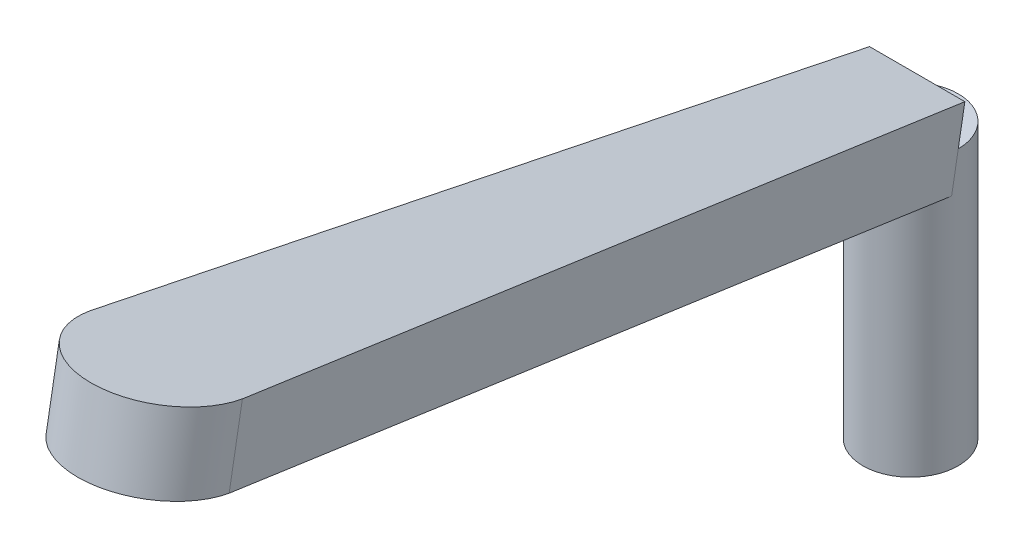
from build123d import *

# Parameters (mm, degrees)
SKETCH1_R           = 7.9375
BOSS_EXTRUDE1_DEPTH = 45.72
BOSS_EXTRUDE2_DEPTH = 6.35


with BuildPart() as part:
    # Sketch1 → Boss-Extrude1 (new body)
    with BuildSketch(Plane(origin=(0, 0, 0), x_dir=(1, 0, 0), z_dir=(0, 1, 0))):
        Circle(SKETCH1_R)
    extrude(amount=BOSS_EXTRUDE1_DEPTH)

    # Sketch2 → Boss-Extrude2 (add, symmetric)
    with BuildSketch(Plane(origin=(0, 44.341373311, -7.818580476), x_dir=(1, 0, 0), z_dir=(0, -0.9848077530122086, 0.17364817766692736))):
        with BuildLine():
            Line((-7.9375, 7.939194683), (7.9375, 7.939194683))
            Line((7.9375, 7.939194683), (12.7, 134.939194683))
            ThreePointArc((12.7, 134.939194683), (0, 147.639194683), (-12.7, 134.939194683))
            Line((-12.7, 134.939194683), (-7.9375, 7.939194683))
        make_face()
    extrude(amount=BOSS_EXTRUDE2_DEPTH, both=True)


solid = part.part
